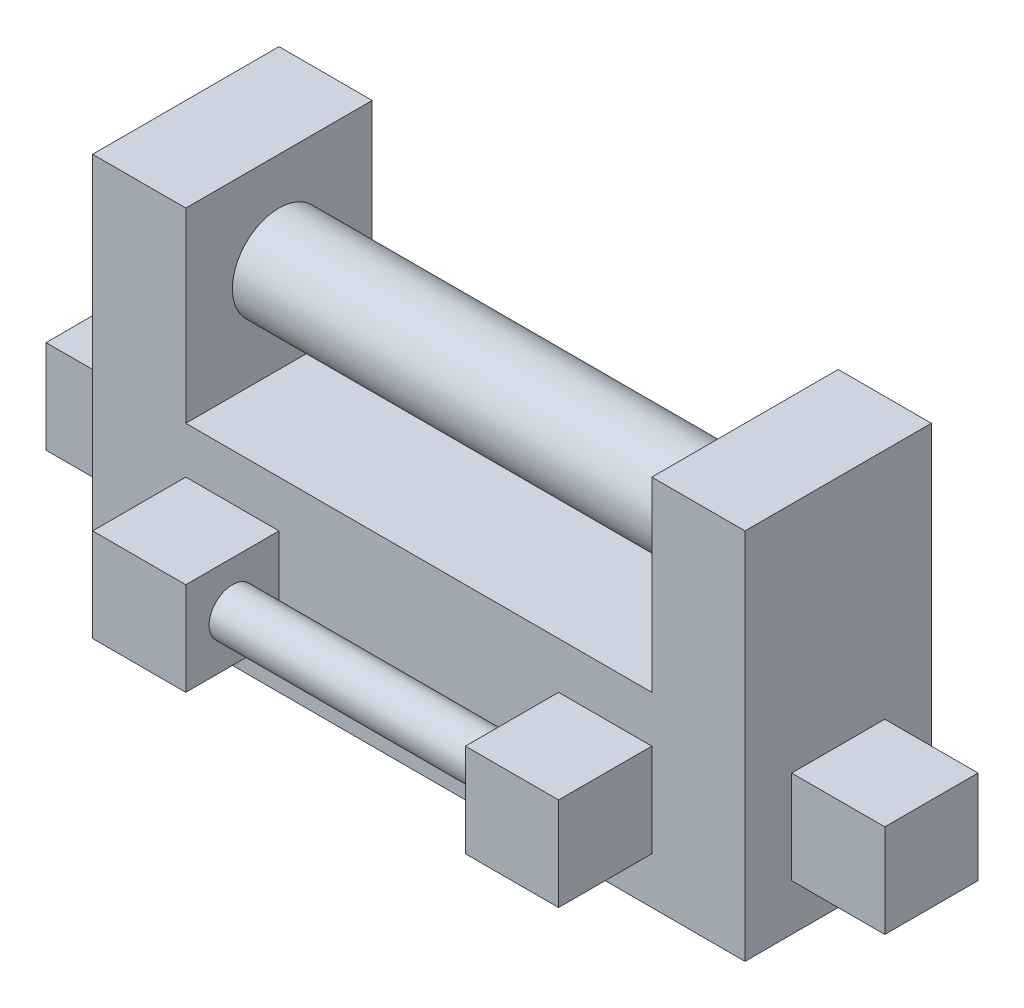
from build123d import *

# Parameters (mm, degrees)
SKETCH1_W           = 10
SKETCH1_H           = 10
BOSS_EXTRUDE1_DEPTH = 10
SKETCH1_3_W         = 10
SKETCH1_3_H         = 10
BOSS_EXTRUDE2_DEPTH = 5
SKETCH1_4_W         = 10
SKETCH1_4_H         = 10
BOSS_EXTRUDE3_DEPTH = 20
BOSS_EXTRUDE4_REACH = 85.066
SKETCH2_R           = 5
BOSS_EXTRUDE5_REACH = 76.833
SKETCH3_R           = 2.5


with BuildPart() as part:
    # Sketch1 → Boss-Extrude1 (new, symmetric)
    with BuildSketch(Plane.XY):
        Polygon((0, 5), (0, 0), (70, 0), (70, 5), (70, 15), (70, 40), (60, 40), (60, 20), (10, 20), (10, 40), (0, 40), (0, 15), align=None)
        with Locations((15, 10)):
            Rectangle(SKETCH1_W, SKETCH1_H, mode=Mode.SUBTRACT)
        with Locations((55, 10)):
            Rectangle(SKETCH1_W, SKETCH1_H, mode=Mode.SUBTRACT)
    extrude(amount=BOSS_EXTRUDE1_DEPTH, both=True)

    # Sketch1<3> → Boss-Extrude2 (add, symmetric)
    with BuildSketch(Plane.XY):
        with Locations((-5, 10)):
            Rectangle(SKETCH1_3_W, SKETCH1_3_H)
        with Locations((75, 10)):
            Rectangle(SKETCH1_3_W, SKETCH1_3_H)
    extrude(amount=BOSS_EXTRUDE2_DEPTH, both=True)

    # Sketch1<4> → Boss-Extrude3 (add, symmetric)
    with BuildSketch(Plane.XY):
        with Locations((15, 10)):
            Rectangle(SKETCH1_4_W, SKETCH1_4_H)
        with Locations((55, 10)):
            Rectangle(SKETCH1_4_W, SKETCH1_4_H)
    extrude(amount=BOSS_EXTRUDE3_DEPTH, both=True)

    # Sketch2 → Boss-Extrude4 (add, up to next)
    with BuildSketch(Plane(origin=(10, 0, 0), x_dir=(0, 0, -1), z_dir=(1, 0, 0)), mode=Mode.PRIVATE) as boss_extrude4_sk1:
        with Locations((0, 30)):
            Circle(SKETCH2_R)
    boss_extrude4_tool1 = extrude(boss_extrude4_sk1.sketch, amount=BOSS_EXTRUDE4_REACH, mode=Mode.PRIVATE) - part.part
    add(boss_extrude4_tool1.solids().sort_by_distance((10, 30, 0))[0])

    # Sketch3 → Boss-Extrude5 (add, up to next)
    with BuildSketch(Plane(origin=(20, 0, 0), x_dir=(0, 0, -1), z_dir=(1, 0, 0)), mode=Mode.PRIVATE) as boss_extrude5_sk1:
        with Locations((-15, 10)):
            Circle(SKETCH3_R)
    boss_extrude5_tool1 = extrude(boss_extrude5_sk1.sketch, amount=BOSS_EXTRUDE5_REACH, mode=Mode.PRIVATE) - part.part
    boss_extrude5 = boss_extrude5_tool1.solids().sort_by_distance((20, 10, 15))[0]
    add(boss_extrude5)

    # Mirror1: Boss-Extrude5 across plane
    add(boss_extrude5.mirror(Plane.XY))


solid = part.part
